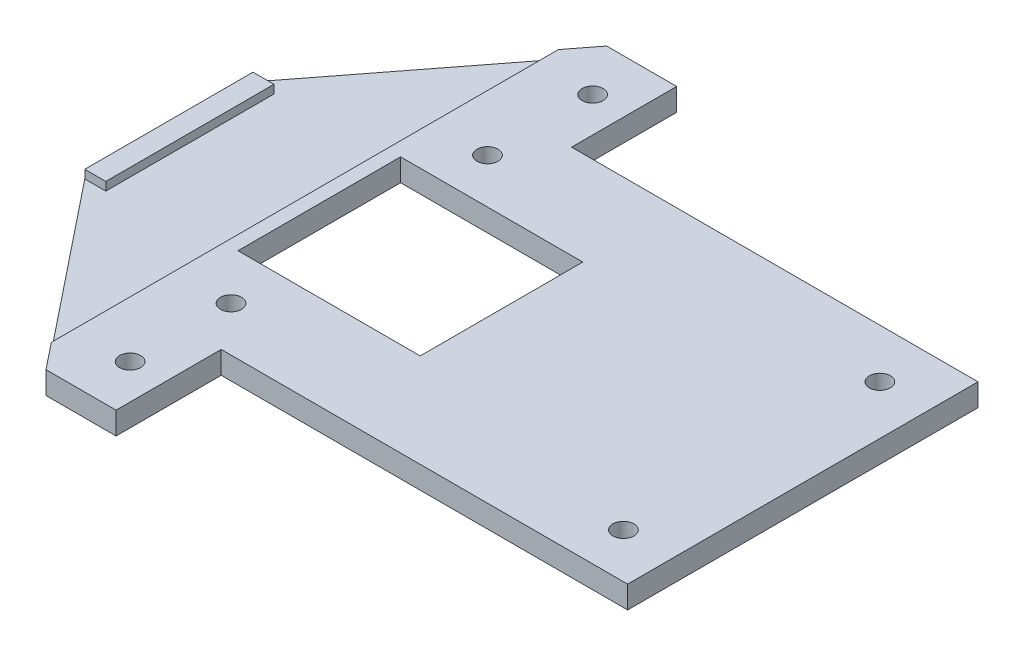
from build123d import *

# Parameters (mm, degrees)
BOSS_EXTRUDE1_DEPTH = 11.6
CUT_EXTRUDE1_DEPTH  = 9.85
SKETCH5_W           = 13
SKETCH5_H           = 11.6
CUT_EXTRUDE3_DEPTH  = 51.592094244
CUT_EXTRUDE5_DEPTH  = 9.85
SKETCH9_W           = 29
SKETCH9_H           = 7.5
CUT_EXTRUDE7_DEPTH  = 51.592094244
SKETCH10_R          = 0.75
CUT_EXTRUDE8_DEPTH  = 51.592094244
SKETCH11_W          = 1.5
SKETCH11_H          = 12
CUT_EXTRUDE9_DEPTH  = 10
CUT_EXTRUDE10_DEPTH = 0.75


with BuildPart() as part:
    # Sketch2 → Boss-Extrude1 (new body)
    with BuildSketch(Plane(origin=(0, 0, 0), x_dir=(1, 0, 0), z_dir=(0, 1, 0))):
        Polygon((0, 5.767018283), (0, -6.232981717), (11, -20), (45, -20), (45, 20), (11, 20), align=None)
    extrude(amount=BOSS_EXTRUDE1_DEPTH)

    # Sketch3 → Cut-Extrude1 (cut)
    with BuildSketch(Plane(origin=(0, 11.6, 0), x_dir=(1, 0, 0), z_dir=(0, 1, 0))):
        Polygon((1.5, 7.707879426), (1.5, -8.110302392), (9.5, -18.122679325), (9.5, 18.059138857), align=None)
    extrude(amount=-CUT_EXTRUDE1_DEPTH, mode=Mode.SUBTRACT)

    # Sketch5 → Cut-Extrude3 (cut, through all)
    with BuildSketch(Plane(origin=(0, 11.6, 0), x_dir=(1, 0, 0), z_dir=(0, 1, 0))):
        with Locations((17, 0)):
            Rectangle(SKETCH5_W, SKETCH5_H)
    extrude(amount=-CUT_EXTRUDE3_DEPTH, mode=Mode.SUBTRACT)

    # Sketch7 → Cut-Extrude5 (cut)
    with BuildSketch(Plane(origin=(0, 11.6, 0), x_dir=(1, 0, 0), z_dir=(0, 1, 0))):
        Polygon((1.5, 7.707879426), (0, 5.767018283), (1.5, 5.767018283), align=None)
        Polygon((0, -6.232981717), (1.5, -6.232981717), (1.5, -8.110302392), align=None)
    extrude(amount=-CUT_EXTRUDE5_DEPTH, mode=Mode.SUBTRACT)

    # Sketch9 → Cut-Extrude7 (cut, through all)
    with BuildSketch(Plane.XZ):
        with Locations((30.5, 16.25)):
            Rectangle(SKETCH9_W, SKETCH9_H)
        with Locations((30.5, -16.25)):
            Rectangle(SKETCH9_W, SKETCH9_H)
    extrude(amount=-CUT_EXTRUDE7_DEPTH, mode=Mode.SUBTRACT)

    # Sketch10 → Cut-Extrude8 (cut, through all)
    with BuildSketch(Plane(origin=(0, 11.6, 0), x_dir=(1, 0, 0), z_dir=(0, 1, 0))):
        with Locations(Location((13.5, 16.5, 0), (0, 0, 270))):
            Circle(SKETCH10_R)
        with Locations(Location((13.5, 9, 0), (0, 0, 270))):
            Circle(SKETCH10_R)
        with Locations(Location((41.5, 9, 0), (0, 0, 270))):
            Circle(SKETCH10_R)
        with Locations(Location((41.5, -9.3, 0), (0, 0, 270))):
            Circle(SKETCH10_R)
        with Locations(Location((13.5, -9.3, 0), (0, 0, 270))):
            Circle(SKETCH10_R)
        with Locations(Location((13.5, -16.5, 0), (0, 0, 270))):
            Circle(SKETCH10_R)
    extrude(amount=-CUT_EXTRUDE8_DEPTH, mode=Mode.SUBTRACT)

    # Sketch11 → Cut-Extrude9 (cut)
    with BuildSketch(Plane(origin=(0, 11.6, 0), x_dir=(1, 0, 0), z_dir=(0, 1, 0))):
        Polygon((9.5, 18.059138857), (9.5, -18.122679325), (11, -20), (16, -20), (16, -12.5), (45, -12.5), (45, 12.5), (16, 12.5), (16, 20), (11, 20), align=None)
        with Locations((0.75, -0.232981717)):
            Rectangle(SKETCH11_W, SKETCH11_H)
    extrude(amount=-CUT_EXTRUDE9_DEPTH, mode=Mode.SUBTRACT)

    # Sketch12 → Cut-Extrude10 (cut)
    with BuildSketch(Plane(origin=(0, 1.75, 0), x_dir=(1, 0, 0), z_dir=(0, 1, 0))):
        Polygon((0, 5.767018283), (9.5, 18.059138857), (9.5, -18.122679325), (0, -6.232981717), (1.5, -6.232981717), (1.5, 5.767018283), align=None)
    extrude(amount=-CUT_EXTRUDE10_DEPTH, mode=Mode.SUBTRACT)


solid = part.part
